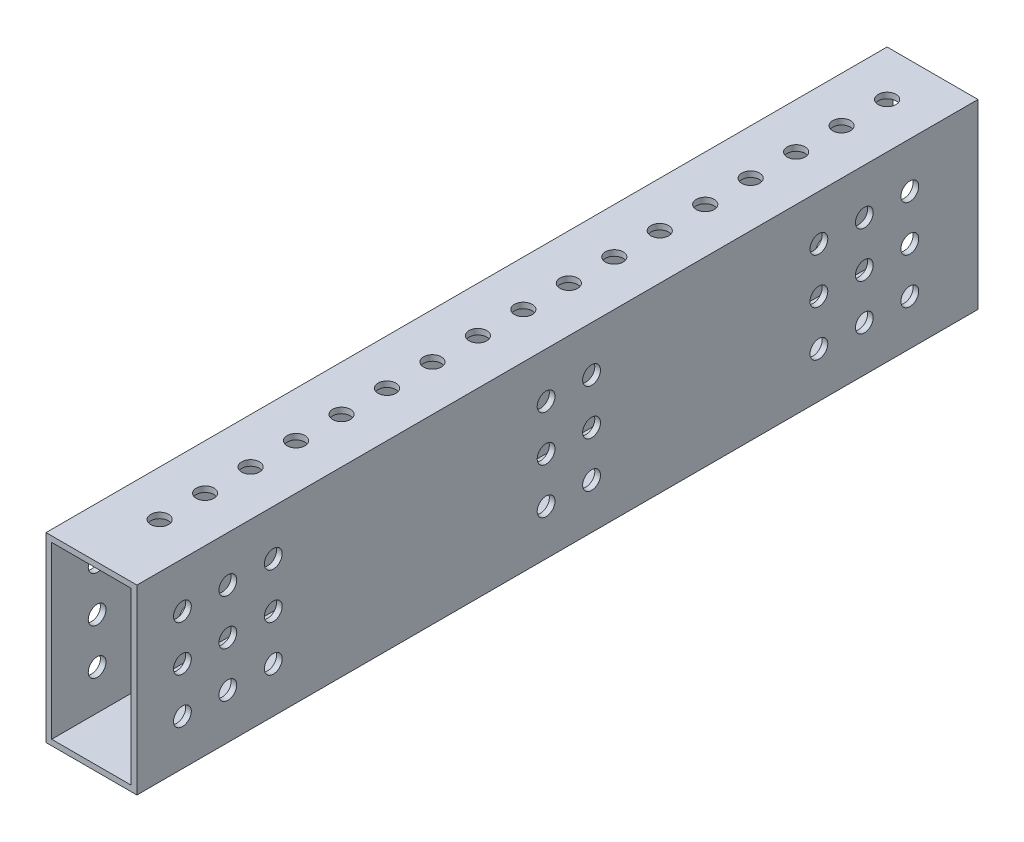
from build123d import *

# Parameters (mm, degrees)
SKETCH1_W           = 234.95
SKETCH1_H           = 50.8
SKETCH1_R           = 2.4892
BOSS_EXTRUDE1_DEPTH = 25.4
SKETCH2_W           = 22.225
SKETCH2_H           = 47.625
CUT_EXTRUDE1_DEPTH  = 242.717402146
SKETCH3_R           = 2.4892
CUT_EXTRUDE2_DEPTH  = 242.717402146


with BuildPart() as part:
    # Sketch1 → Boss-Extrude1 (new body)
    with BuildSketch(Plane(origin=(0, 0, 0), x_dir=(0, 0, -1), z_dir=(1, 0, 0))):
        with Locations((117.475, 25.4)):
            Rectangle(SKETCH1_W, SKETCH1_H)
        with Locations((12.7, 25.4)):
            Circle(SKETCH1_R, mode=Mode.SUBTRACT)
        with Locations((12.7, 38.1)):
            Circle(SKETCH1_R, mode=Mode.SUBTRACT)
        with Locations((12.7, 12.7)):
            Circle(SKETCH1_R, mode=Mode.SUBTRACT)
        with Locations((25.4, 12.7)):
            Circle(SKETCH1_R, mode=Mode.SUBTRACT)
        with Locations((25.4, 25.4)):
            Circle(SKETCH1_R, mode=Mode.SUBTRACT)
        with Locations((25.4, 38.1)):
            Circle(SKETCH1_R, mode=Mode.SUBTRACT)
        with Locations((38.1, 12.7)):
            Circle(SKETCH1_R, mode=Mode.SUBTRACT)
        with Locations((38.1, 25.4)):
            Circle(SKETCH1_R, mode=Mode.SUBTRACT)
        with Locations((38.1, 38.1)):
            Circle(SKETCH1_R, mode=Mode.SUBTRACT)
        with Locations((114.3, 12.7)):
            Circle(SKETCH1_R, mode=Mode.SUBTRACT)
        with Locations((114.3, 25.4)):
            Circle(SKETCH1_R, mode=Mode.SUBTRACT)
        with Locations((114.3, 38.1)):
            Circle(SKETCH1_R, mode=Mode.SUBTRACT)
        with Locations((127, 12.7)):
            Circle(SKETCH1_R, mode=Mode.SUBTRACT)
        with Locations((127, 25.4)):
            Circle(SKETCH1_R, mode=Mode.SUBTRACT)
        with Locations((127, 38.1)):
            Circle(SKETCH1_R, mode=Mode.SUBTRACT)
        with Locations((190.5, 12.7)):
            Circle(SKETCH1_R, mode=Mode.SUBTRACT)
        with Locations((190.5, 25.4)):
            Circle(SKETCH1_R, mode=Mode.SUBTRACT)
        with Locations((190.5, 38.1)):
            Circle(SKETCH1_R, mode=Mode.SUBTRACT)
        with Locations((203.2, 12.7)):
            Circle(SKETCH1_R, mode=Mode.SUBTRACT)
        with Locations((203.2, 25.4)):
            Circle(SKETCH1_R, mode=Mode.SUBTRACT)
        with Locations((203.2, 38.1)):
            Circle(SKETCH1_R, mode=Mode.SUBTRACT)
        with Locations((215.9, 12.7)):
            Circle(SKETCH1_R, mode=Mode.SUBTRACT)
        with Locations((215.9, 25.4)):
            Circle(SKETCH1_R, mode=Mode.SUBTRACT)
        with Locations((215.9, 38.1)):
            Circle(SKETCH1_R, mode=Mode.SUBTRACT)
    extrude(amount=BOSS_EXTRUDE1_DEPTH)

    # Sketch2 → Cut-Extrude1 (cut, through all)
    with BuildSketch(Plane.XY):
        with Locations((12.7, 25.4)):
            Rectangle(SKETCH2_W, SKETCH2_H)
    extrude(amount=-CUT_EXTRUDE1_DEPTH, mode=Mode.SUBTRACT)

    # Sketch3 → Cut-Extrude2 (cut, through all)
    with BuildSketch(Plane(origin=(0, 50.8, 0), x_dir=(1, 0, 0), z_dir=(0, 1, 0))):
        with Locations(Location((12.7, 222.25, 0), (0, 0, 270))):
            Circle(SKETCH3_R)
        with Locations(Location((12.7, 209.55, 0), (0, 0, 270))):
            Circle(SKETCH3_R)
        with Locations(Location((12.7, 196.85, 0), (0, 0, 270))):
            Circle(SKETCH3_R)
        with Locations(Location((12.7, 184.15, 0), (0, 0, 270))):
            Circle(SKETCH3_R)
        with Locations(Location((12.7, 171.45, 0), (0, 0, 270))):
            Circle(SKETCH3_R)
        with Locations(Location((12.7, 158.75, 0), (0, 0, 270))):
            Circle(SKETCH3_R)
        with Locations(Location((12.7, 146.05, 0), (0, 0, 270))):
            Circle(SKETCH3_R)
        with Locations(Location((12.7, 133.35, 0), (0, 0, 270))):
            Circle(SKETCH3_R)
        with Locations(Location((12.7, 120.65, 0), (0, 0, 270))):
            Circle(SKETCH3_R)
        with Locations(Location((12.7, 107.95, 0), (0, 0, 270))):
            Circle(SKETCH3_R)
        with Locations(Location((12.7, 95.25, 0), (0, 0, 270))):
            Circle(SKETCH3_R)
        with Locations(Location((12.7, 82.55, 0), (0, 0, 270))):
            Circle(SKETCH3_R)
        with Locations(Location((12.7, 69.85, 0), (0, 0, 270))):
            Circle(SKETCH3_R)
        with Locations(Location((12.7, 57.15, 0), (0, 0, 270))):
            Circle(SKETCH3_R)
        with Locations(Location((12.7, 44.45, 0), (0, 0, 270))):
            Circle(SKETCH3_R)
        with Locations(Location((12.7, 31.75, 0), (0, 0, 270))):
            Circle(SKETCH3_R)
        with Locations(Location((12.7, 19.05, 0), (0, 0, 270))):
            Circle(SKETCH3_R)
    extrude(amount=-CUT_EXTRUDE2_DEPTH, mode=Mode.SUBTRACT)


solid = part.part
